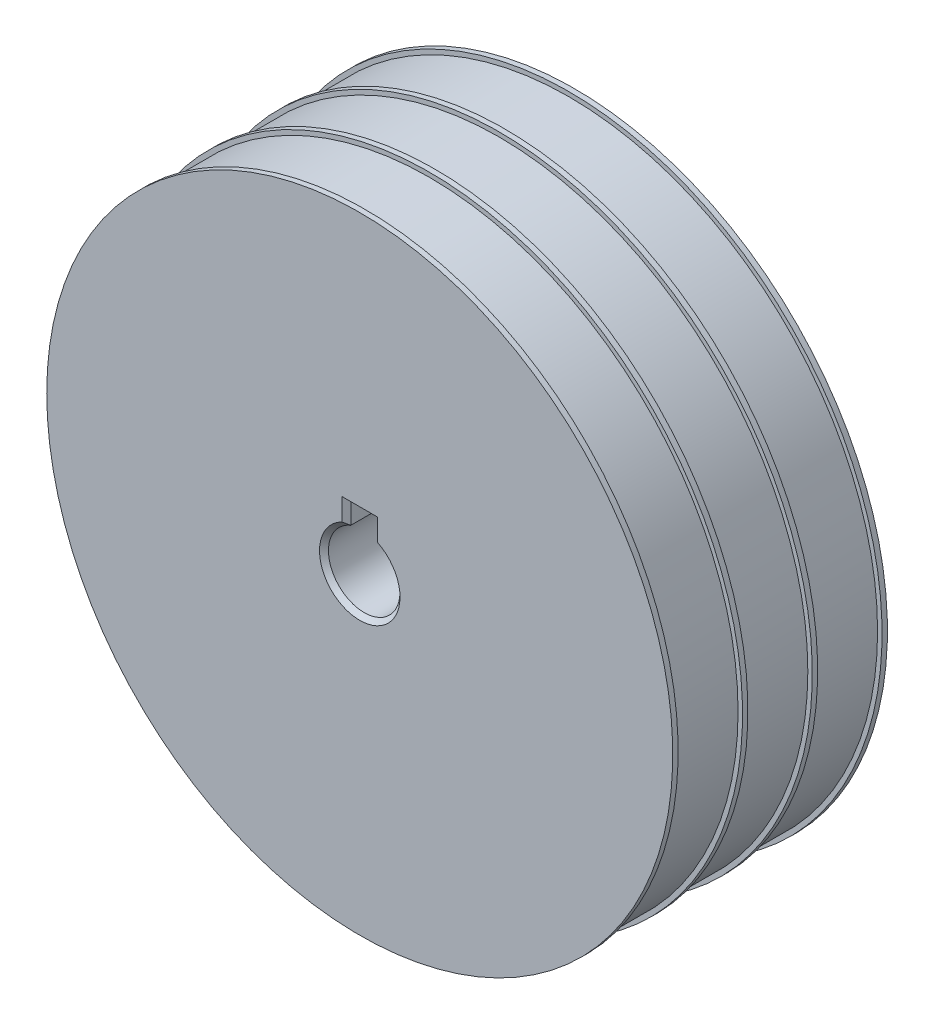
from build123d import *

# Parameters (mm, degrees)
SKETCH2_W          = 3
SKETCH2_H          = 6
CUT_EXTRUDE1_DEPTH = 56.009090158
CHAMFER1_SIZE      = 0.5


with BuildPart() as part:
    # Sketch1 → Revolve1 (revolve)
    with BuildSketch(Plane(origin=(0, 0, 0), x_dir=(1, 0, 0), z_dir=(0, 1, 0))):
        Polygon((-4, 25.890517241), (-35, 25.890517241), (-35, 25.290517241), (-34.5, 25.290517241), (-34.5, 18.090517241), (-35, 18.090517241), (-35, 17.490517241), (-34.5, 17.490517241), (-34.5, 10.290517241), (-35, 10.290517241), (-35, 9.690517241), (-34.5, 9.690517241), (-34.5, 2.490517241), (-35, 2.490517241), (-35, 1.890517241), (-4, 1.890517241), align=None)
    revolve(axis=Axis((0, 0, -42.552298851), (0, 0, 1)))

    # Sketch2 → Cut-Extrude1 (cut, through all)
    with BuildSketch(Plane(origin=(0, 0, -25.890517241), x_dir=(-1, 0, 0), z_dir=(0, 0, -1))):
        with Locations((0, 3)):
            Rectangle(SKETCH2_W, SKETCH2_H)
    extrude(amount=-CUT_EXTRUDE1_DEPTH, mode=Mode.SUBTRACT)

    # Chamfer1
    chamfer1_edges = [part.edges().sort_by_distance(p)[0] for p in [
        (0, -4, -25.890517241),
        (-1.5, 4.854049622, -25.890517241),
        (0, -4, -1.890517241),
        (-1.5, 4.854049622, -1.890517241),
        (1.5, 4.854049622, -1.890517241),
        (0, 6, -1.890517241),
        (0, 6, -25.890517241),
        (1.5, 4.854049622, -25.890517241),
    ]]
    chamfer(chamfer1_edges, length=CHAMFER1_SIZE)


solid = part.part
